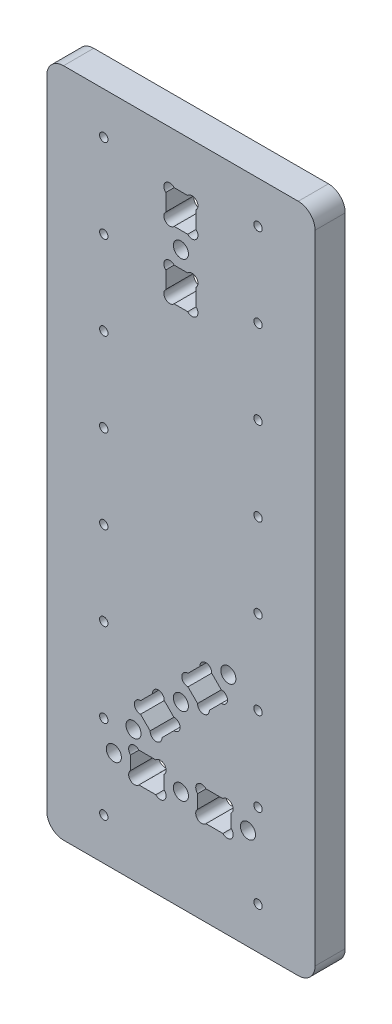
from build123d import *

# Parameters (mm, degrees)
ESQUISSE1_W                  = 80
ESQUISSE1_H                  = 200
BOSS_EXTRU_1_DEPTH           = 9
ENL_V_MAT_EXTRU_1_DEPTH      = 216.594526832
ENL_V_MAT_EXTRU_1_DEPTH_BACK = 216.594526832
ESQUISSE2_R                  = 1.25
ENL_V_MAT_EXTRU_2_DEPTH      = 216.594526832
ENL_V_MAT_EXTRU_2_DEPTH_BACK = 216.594526832
CONG_1_R                     = 5
ENL_V_MAT_EXTRU_3_DEPTH      = 216.594526832
ENL_V_MAT_EXTRU_3_DEPTH_BACK = 216.594526832
ESQUISSE4_R                  = 2.25
ENL_V_MAT_EXTRU_4_DEPTH      = 216.594526832
ENL_V_MAT_EXTRU_4_DEPTH_BACK = 216.594526832
ESQUISSE5_R                  = 2.25


with BuildPart() as part:
    # Esquisse1 → Boss.-Extru.1 (new body)
    with BuildSketch(Plane.XY):
        with Locations((40, 100)):
            Rectangle(ESQUISSE1_W, ESQUISSE1_H)
    extrude(amount=BOSS_EXTRU_1_DEPTH)

    # Esquisse2 → Enlèv. mat.-Extru.1 (cut, two sides: drawn at the far end of the back side and taken through both)
    with BuildSketch(Plane.XY.offset(9).offset(-ENL_V_MAT_EXTRU_1_DEPTH_BACK)):
        with Locations(Location((17, 187.5, 0), (0, 0, 180))):
            Circle(ESQUISSE2_R)
        with Locations((17, 87.5)):
            Circle(ESQUISSE2_R)
        with Locations((17, 62.5)):
            Circle(ESQUISSE2_R)
        with Locations((17, 37.5)):
            Circle(ESQUISSE2_R)
        with Locations((17, 12.5)):
            Circle(ESQUISSE2_R)
        with Locations(Location((17, 162.5, 0), (0, 0, 180))):
            Circle(ESQUISSE2_R)
        with Locations(Location((17, 137.5, 0), (0, 0, 180))):
            Circle(ESQUISSE2_R)
        with Locations(Location((17, 112.5, 0), (0, 0, 180))):
            Circle(ESQUISSE2_R)
        with Locations((63, 112.5)):
            Circle(ESQUISSE2_R)
        with Locations((63, 137.5)):
            Circle(ESQUISSE2_R)
        with Locations((63, 162.5)):
            Circle(ESQUISSE2_R)
        with Locations(Location((63, 12.5, 0), (0, 0, 180))):
            Circle(ESQUISSE2_R)
        with Locations(Location((63, 37.5, 0), (0, 0, 180))):
            Circle(ESQUISSE2_R)
        with Locations(Location((63, 62.5, 0), (0, 0, 180))):
            Circle(ESQUISSE2_R)
        with Locations(Location((63, 87.5, 0), (0, 0, 180))):
            Circle(ESQUISSE2_R)
        with Locations((63, 187.5)):
            Circle(ESQUISSE2_R)
    extrude(amount=ENL_V_MAT_EXTRU_1_DEPTH + ENL_V_MAT_EXTRU_1_DEPTH_BACK, mode=Mode.SUBTRACT)

    # Esquisse3 → Enlèv. mat.-Extru.2 (cut, two sides: drawn at the far end of the back side and taken through both)
    with BuildSketch(Plane.XY.offset(9).offset(-ENL_V_MAT_EXTRU_2_DEPTH_BACK)):
        Polygon((46.717514421, 53.535533906), (53.788582233, 60.606601718), (47.424621202, 66.970562748), (40.353553391, 59.899494937), align=None)
        Polygon((33.282485579, 52.828427125), (39.646446609, 46.464466094), (32.575378798, 39.393398282), (26.211417767, 45.757359313), align=None)
    extrude(amount=ENL_V_MAT_EXTRU_2_DEPTH + ENL_V_MAT_EXTRU_2_DEPTH_BACK, mode=Mode.SUBTRACT)

    # Congé1
    cong_1_edges = [part.edges().sort_by_distance(p)[0] for p in [
        (0, 200, 4.5),
        (80, 200, 4.5),
        (80, 0, 4.5),
        (0, 0, 4.5),
    ]]
    fillet(cong_1_edges, radius=CONG_1_R)

    # Esquisse4 → Enlèv. mat.-Extru.3 (cut, two sides: drawn at the far end of the back side and taken through both)
    with BuildSketch(Plane.XY.offset(9).offset(-ENL_V_MAT_EXTRU_3_DEPTH_BACK)):
        with Locations((40, 53.181980515)):
            Circle(ESQUISSE4_R)
        with Locations((25.857864376, 39.039844892)):
            Circle(ESQUISSE4_R)
        with Locations(Location((54.142135624, 67.324116139, 0), (0, 0, 180))):
            Circle(ESQUISSE4_R)
        with BuildLine():
            Line((27.961417767, 47.507359313), (27.961417767, 44.007359313))
            ThreePointArc((27.961417767, 44.007359313), (26.111417767, 45.757359313), (27.961417767, 47.507359313))
        make_face()
        with BuildLine():
            Line((31.532485579, 51.078427125), (35.032485579, 51.078427125))
            ThreePointArc((35.032485579, 51.078427125), (33.282485579, 52.928427125), (31.532485579, 51.078427125))
        make_face()
        with BuildLine():
            Line((37.896446609, 44.714466094), (37.896446609, 48.214466094))
            ThreePointArc((37.896446609, 48.214466094), (39.746446609, 46.464466094), (37.896446609, 44.714466094))
        make_face()
        with BuildLine():
            Line((34.325378798, 41.143398282), (30.825378798, 41.143398282))
            ThreePointArc((30.825378798, 41.143398282), (32.575378798, 39.293398282), (34.325378798, 41.143398282))
        make_face()
        with BuildLine():
            Line((52.038582233, 58.856601718), (52.038582233, 62.356601718))
            ThreePointArc((52.038582233, 62.356601718), (53.888582233, 60.606601718), (52.038582233, 58.856601718))
        make_face()
        with BuildLine():
            Line((48.467514421, 55.285533906), (44.967514421, 55.285533906))
            ThreePointArc((44.967514421, 55.285533906), (46.717514421, 53.435533906), (48.467514421, 55.285533906))
        make_face()
        with BuildLine():
            Line((42.103553391, 61.649494937), (42.103553391, 58.149494937))
            ThreePointArc((42.103553391, 58.149494937), (40.253553391, 59.899494937), (42.103553391, 61.649494937))
        make_face()
        with BuildLine():
            Line((45.674621202, 65.220562748), (49.174621202, 65.220562748))
            ThreePointArc((49.174621202, 65.220562748), (47.424621202, 67.070562748), (45.674621202, 65.220562748))
        make_face()
    extrude(amount=ENL_V_MAT_EXTRU_3_DEPTH + ENL_V_MAT_EXTRU_3_DEPTH_BACK, mode=Mode.SUBTRACT)

    # Esquisse5 → Enlèv. mat.-Extru.4 (cut, two sides: drawn at the far end of the back side and taken through both)
    with BuildSketch(Plane.XY.offset(9).offset(-ENL_V_MAT_EXTRU_4_DEPTH_BACK)):
        with Locations((60, 30)):
            Circle(ESQUISSE5_R)
        with Locations((40, 30)):
            Circle(ESQUISSE5_R)
        with Locations((20, 30)):
            Circle(ESQUISSE5_R)
        with Locations((40, 170)):
            Circle(ESQUISSE5_R)
        with BuildLine():
            Line((52.525126266, 25.5), (47.474873734, 25.5))
            ThreePointArc((47.474873734, 25.5), (44.929289322, 25.429289322), (45, 27.974873734))
            Line((45, 27.974873734), (45, 32.025126266))
            ThreePointArc((45, 32.025126266), (44.929289322, 34.570710678), (47.474873734, 34.5))
            Line((47.474873734, 34.5), (52.525126266, 34.5))
            ThreePointArc((52.525126266, 34.5), (55.070710678, 34.570710678), (55, 32.025126266))
            Line((55, 32.025126266), (55, 27.974873734))
            ThreePointArc((55, 27.974873734), (55.070710678, 25.429289322), (52.525126266, 25.5))
        make_face()
        with BuildLine():
            Line((32.525126266, 25.5), (27.474873734, 25.5))
            ThreePointArc((27.474873734, 25.5), (24.929289322, 25.429289322), (25, 27.974873734))
            Line((25, 27.974873734), (25, 32.025126266))
            ThreePointArc((25, 32.025126266), (24.929289322, 34.570710678), (27.474873734, 34.5))
            Line((27.474873734, 34.5), (32.525126266, 34.5))
            ThreePointArc((32.525126266, 34.5), (35.070710678, 34.570710678), (35, 32.025126266))
            Line((35, 32.025126266), (35, 27.974873734))
            ThreePointArc((35, 27.974873734), (35.070710678, 25.429289322), (32.525126266, 25.5))
        make_face()
        with BuildLine():
            Line((44.5, 182.525126266), (44.5, 177.474873734))
            ThreePointArc((44.5, 177.474873734), (44.570710678, 174.929289322), (42.025126266, 175))
            Line((42.025126266, 175), (37.974873734, 175))
            ThreePointArc((37.974873734, 175), (35.429289322, 174.929289322), (35.5, 177.474873734))
            Line((35.5, 177.474873734), (35.5, 182.525126266))
            ThreePointArc((35.5, 182.525126266), (35.429289322, 185.070710678), (37.974873734, 185))
            Line((37.974873734, 185), (42.025126266, 185))
            ThreePointArc((42.025126266, 185), (44.570710678, 185.070710678), (44.5, 182.525126266))
        make_face()
        with BuildLine():
            Line((44.5, 162.525126266), (44.5, 157.474873734))
            ThreePointArc((44.5, 157.474873734), (44.570710678, 154.929289322), (42.025126266, 155))
            Line((42.025126266, 155), (37.974873734, 155))
            ThreePointArc((37.974873734, 155), (35.429289322, 154.929289322), (35.5, 157.474873734))
            Line((35.5, 157.474873734), (35.5, 162.525126266))
            ThreePointArc((35.5, 162.525126266), (35.429289322, 165.070710678), (37.974873734, 165))
            Line((37.974873734, 165), (42.025126266, 165))
            ThreePointArc((42.025126266, 165), (44.570710678, 165.070710678), (44.5, 162.525126266))
        make_face()
    extrude(amount=ENL_V_MAT_EXTRU_4_DEPTH + ENL_V_MAT_EXTRU_4_DEPTH_BACK, mode=Mode.SUBTRACT)


solid = part.part
